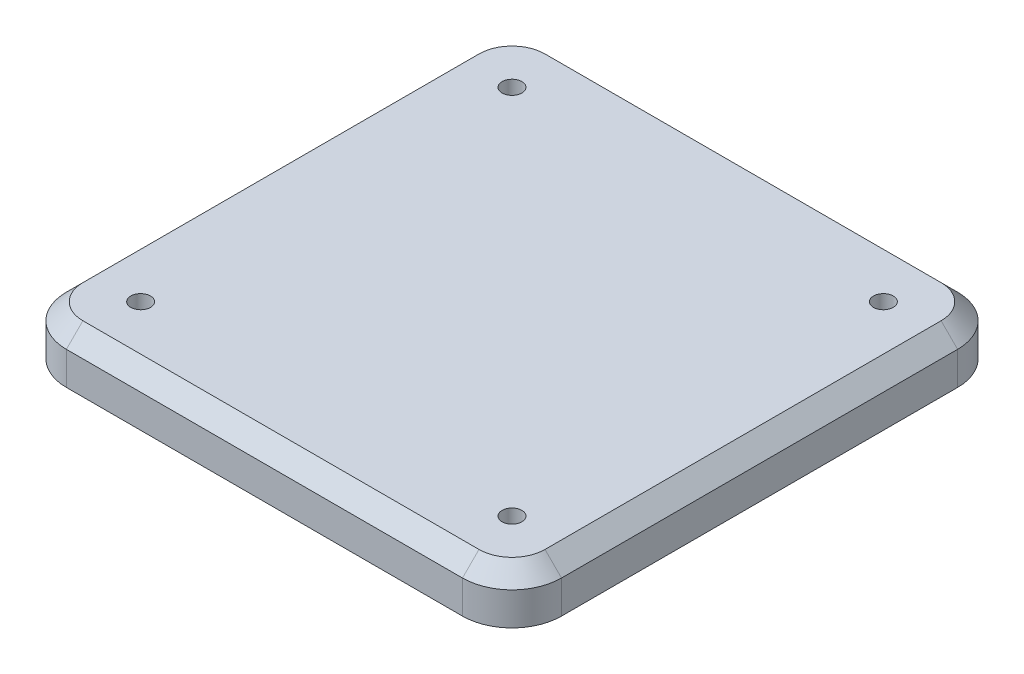
from build123d import *

# Parameters (mm, degrees)
SKETCH_1_W      = 300
SKETCH_1_H      = 300
EXTRUDE_1_DEPTH = 30
FILLET_1_R      = 30
CHAMFER_1_SIZE  = 10


with BuildPart() as part:
    # 草圖1 → 擠出1 (new body)
    with BuildSketch(Plane(origin=(0, 0, 0), x_dir=(-1, 0, 0), z_dir=(0, 1, 0))):
        with Locations((-150, -150)):
            Rectangle(SKETCH_1_W, SKETCH_1_H)
    extrude(amount=EXTRUDE_1_DEPTH)

    # 圓角1
    fillet_1_edges = [part.edges().sort_by_distance(p)[0] for p in [
        (0, 15, -300),
        (300, 15, -300),
        (300, 15, 0),
        (0, 15, 0),
    ]]
    fillet(fillet_1_edges, radius=FILLET_1_R)

    # 倒角1
    chamfer_1_edges = [part.edges().sort_by_distance(p)[0] for p in [
        (150, 30, -300),
        (300, 30, -150),
        (0, 30, -150),
        (150, 30, 0),
        (291.213203436, 30, -8.786796564),
        (8.786796564, 30, -8.786796564),
        (8.786796564, 30, -291.213203436),
        (291.213203436, 30, -291.213203436),
    ]]
    chamfer(chamfer_1_edges, length=CHAMFER_1_SIZE)

    # 草圖2 → 孔2 (revolve, cut)
    with BuildSketch(Plane(origin=(37.5, 30, -37.5), x_dir=(0, 0, 1), z_dir=(1, 0, 0))):
        Polygon((0, 0), (0, 13.605163714), (6, 10), (6, 0), align=None)
    hole_wizard_2 = revolve(axis=Axis((37.5, 34.244199587, -37.5), (0, -1, 0)), mode=Mode.SUBTRACT)

    # 草圖4 → 孔3 (revolve, cut)
    with BuildSketch(Plane(origin=(25, 0, -25), x_dir=(0, 0, -1), z_dir=(1, 0, 0))):
        Polygon((0, 0), (0, 13.605163714), (6, 10), (6, 0), align=None)
    hole_wizard_3 = revolve(axis=Axis((25, -4.244199587, -25), (0, 1, 0)), mode=Mode.SUBTRACT)

    # 鏡射1: 孔2, 孔3 across plane
    add(hole_wizard_2.mirror(Plane(origin=(30, 0, -150), x_dir=(1, 0, 0), z_dir=(0, 0, 1))), mode=Mode.SUBTRACT)
    add(hole_wizard_3.mirror(Plane(origin=(30, 0, -150), x_dir=(1, 0, 0), z_dir=(0, 0, 1))), mode=Mode.SUBTRACT)

    # 鏡射2: 孔2, 孔3 across plane
    add(hole_wizard_2.mirror(Plane(origin=(150, 0, -30), x_dir=(0, 0, 1), z_dir=(1, 0, 0))), mode=Mode.SUBTRACT)
    add(hole_wizard_3.mirror(Plane(origin=(150, 0, -30), x_dir=(0, 0, 1), z_dir=(1, 0, 0))), mode=Mode.SUBTRACT)

    # 鏡射2 copy 1 sketch → 鏡射2 copy 1 (revolve, cut)
    with BuildSketch(Plane(origin=(262.5, 30, -262.5), x_dir=(0, 0, -1), z_dir=(-1, 0, 0))):
        Polygon((0, 0), (0, 13.605163714), (6, 10), (6, 0), align=None)
    revolve(axis=Axis((262.5, 34.244199587, -262.5), (0, -1, 0)), mode=Mode.SUBTRACT)

    # 鏡射2 copy 2 sketch → 鏡射2 copy 2 (revolve, cut)
    with BuildSketch(Plane(origin=(275, 0, -275), x_dir=(0, 0, 1), z_dir=(-1, 0, 0))):
        Polygon((0, 0), (0, 13.605163714), (6, 10), (6, 0), align=None)
    revolve(axis=Axis((275, -4.244199587, -275), (0, 1, 0)), mode=Mode.SUBTRACT)


solid = part.part
